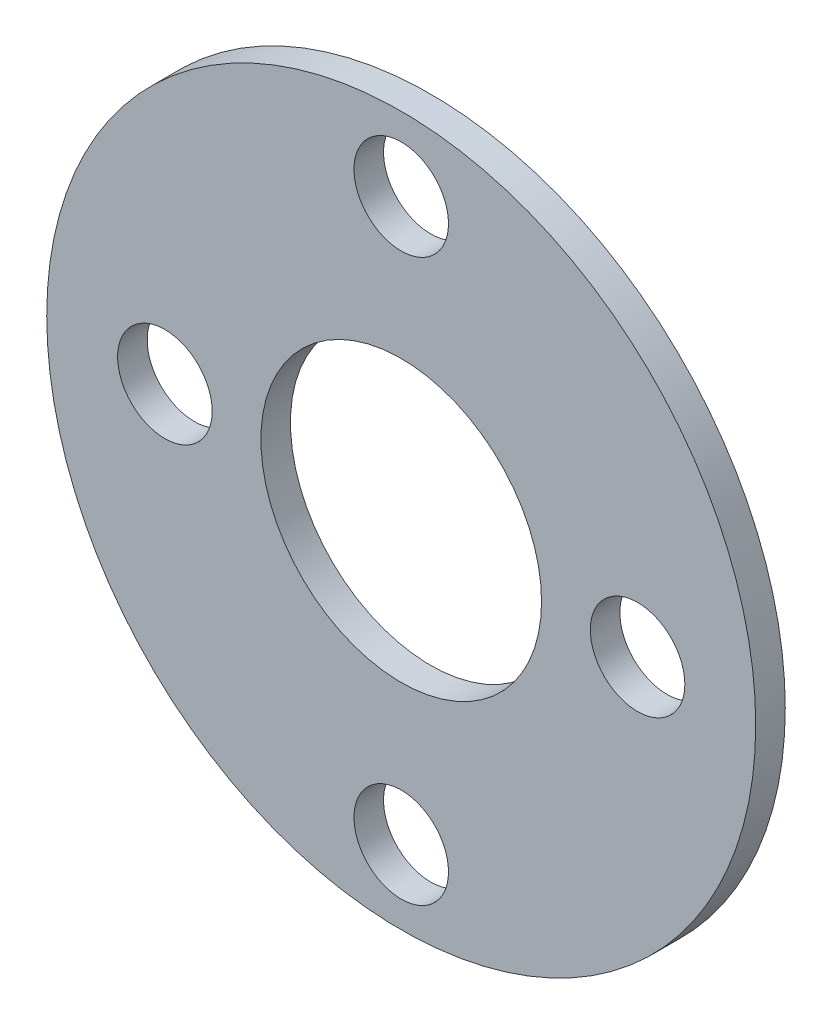
from build123d import *

# Parameters (mm, degrees)
SKETCH_1_R      = 12
SKETCH_1_R_2    = 4.75
SKETCH_1_R_3    = 1.6
EXTRUDE_1_DEPTH = 1


with BuildPart() as part:
    # 草图1 → 凸台-拉伸1 (new body)
    with BuildSketch(Plane.XY):
        Circle(SKETCH_1_R)
        Circle(SKETCH_1_R_2, mode=Mode.SUBTRACT)
        with Locations((8, 0)):
            Circle(SKETCH_1_R_3, mode=Mode.SUBTRACT)
        with Locations((-8, 0)):
            Circle(SKETCH_1_R_3, mode=Mode.SUBTRACT)
        with Locations((0, 9.5)):
            Circle(SKETCH_1_R_3, mode=Mode.SUBTRACT)
        with Locations((0, -9.5)):
            Circle(SKETCH_1_R_3, mode=Mode.SUBTRACT)
    extrude(amount=EXTRUDE_1_DEPTH)


solid = part.part
